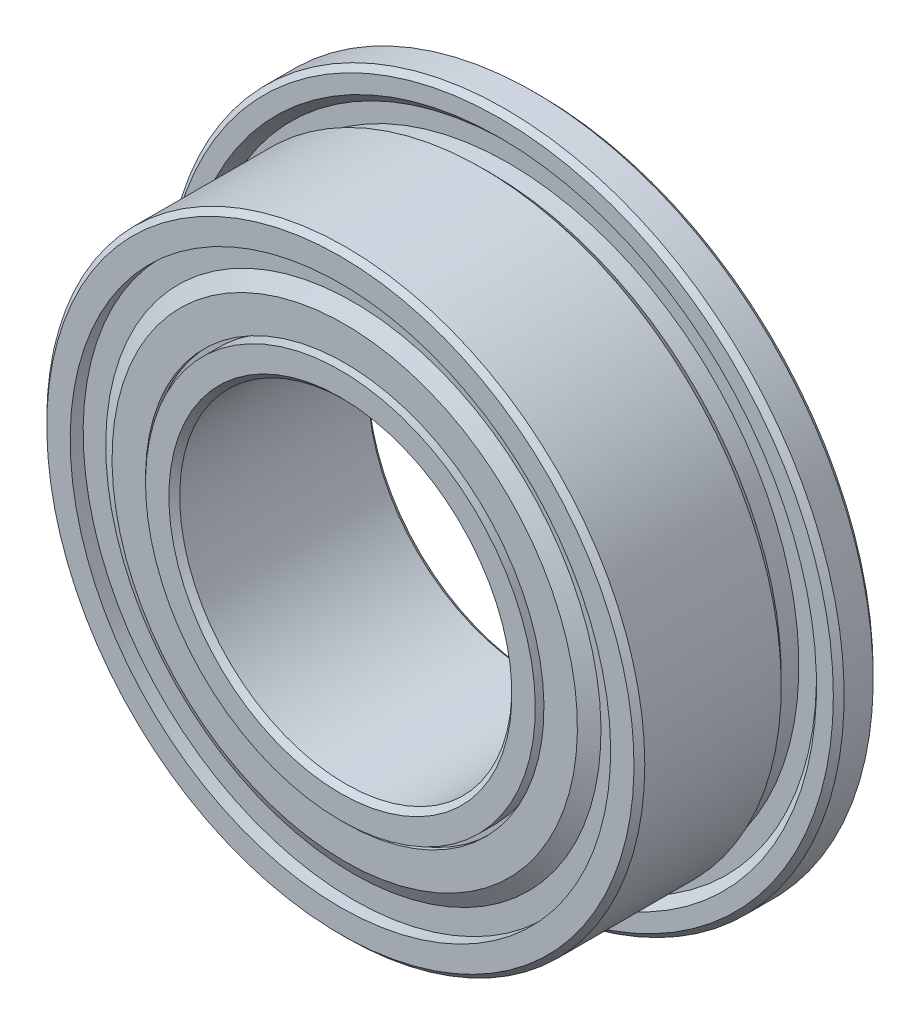
from build123d import *

# Parameters (mm, degrees)
FILLET1_SIZE      = 0.08125
FILLET2_SIZE      = 0.08125
CIRPATTERN3_COUNT = 14
SKETCH8_W         = 0.26
SKETCH8_H         = 0.216666667


with BuildPart() as part:
    # Sketch2 → Revolve1 (revolve)
    with BuildSketch(Plane(origin=(0, 0, 0), x_dir=(0, 0, -1), z_dir=(1, 0, 0)), mode=Mode.PRIVATE) as revolve1_sk:
        with BuildLine():
            Line((1.5, 5.1), (0.9, 5.1))
            Line((0.9, 5.1), (0.9, 4.765165043))
            Line((0.9, 4.765165043), (1.032582521, 4.632582521))
            Line((1.032582521, 4.632582521), (1.032582521, 4.367417479))
            Line((1.032582521, 4.367417479), (0.767417479, 4.367417479))
            Line((0.767417479, 4.367417479), (0.634834957, 4.5))
            Line((0.634834957, 4.5), (-1.5, 4.5))
            Line((-1.5, 4.5), (-1.5, 3.85))
            Line((-1.5, 3.85), (-0.487339717, 3.85))
            ThreePointArc((-0.487339717, 3.85), (0, 4.1), (0.487339717, 3.85))
            Line((0.487339717, 3.85), (1.5, 3.85))
            Line((1.5, 3.85), (1.5, 5.1))
        make_face()
        with BuildLine():
            Line((1.5, 2.5), (-1.5, 2.5))
            Line((-1.5, 2.5), (-1.5, 3.15))
            Line((-1.5, 3.15), (-0.487339717, 3.15))
            ThreePointArc((-0.487339717, 3.15), (0, 2.9), (0.487339717, 3.15))
            Line((0.487339717, 3.15), (1.5, 3.15))
            Line((1.5, 3.15), (1.5, 2.5))
        make_face()
    revolve(revolve1_sk.sketch.rotate(Axis((0, 0, 0), (0, 0, -1)), 180), axis=Axis((0, 0, 0), (0, 0, -1)))

    # Fillet1
    fillet1_edges = [part.edges().sort_by_distance(p)[0] for p in [
        (0, 4.5, 1.5),
        (0, 5.1, -1.5),
        (0, 5.1, -0.9),
    ]]
    chamfer(fillet1_edges, length=FILLET1_SIZE)

    # Fillet2
    fillet2_edges = [part.edges().sort_by_distance(p)[0] for p in [
        (0, 2.5, -1.5),
        (0, 2.5, 1.5),
    ]]
    chamfer(fillet2_edges, length=FILLET2_SIZE)

    # Sketch8 → Cut-Revolve1 (revolve, cut)
    with BuildSketch(Plane(origin=(0, 0, 0), x_dir=(0, 0, -1), z_dir=(1, 0, 0)), mode=Mode.PRIVATE) as cut_revolve1_sk:
        with Locations((-1.37, 3.958333334)):
            Rectangle(SKETCH8_W, SKETCH8_H)
        with Locations((1.37, 3.958333334)):
            Rectangle(SKETCH8_W, SKETCH8_H)
        with Locations((1.37, 3.041666667)):
            Rectangle(SKETCH8_W, SKETCH8_H)
        with Locations((-1.37, 3.041666667)):
            Rectangle(SKETCH8_W, SKETCH8_H)
    revolve(cut_revolve1_sk.sketch.rotate(Axis((0, 0, 0), (0, 0, -1)), 180), axis=Axis((0, 0, 0), (0, 0, -1)), mode=Mode.SUBTRACT)


with BuildPart() as body_2:
    # Sketch7 → Revolve3 (revolve)
    with BuildSketch(Plane.XY):
        with BuildLine():
            Line((0, 4.1), (0, 2.9))
            ThreePointArc((0, 2.9), (-0.6, 3.5), (0, 4.1))
        make_face()
    revolve(axis=Axis((0, 4.1, 0), (0, -1, 0)))


with BuildPart() as cirpattern3_1:
    # CirPattern3: pattern copy
    add(body_2.part.rotate(Axis((0, 0, 0), (0, 0, 1)), 1 * 360 / CIRPATTERN3_COUNT))


with BuildPart() as cirpattern3_2:
    # CirPattern3: pattern copy
    add(body_2.part.rotate(Axis((0, 0, 0), (0, 0, 1)), 2 * 360 / CIRPATTERN3_COUNT))


with BuildPart() as cirpattern3_3:
    # CirPattern3: pattern copy
    add(body_2.part.rotate(Axis((0, 0, 0), (0, 0, 1)), 3 * 360 / CIRPATTERN3_COUNT))


with BuildPart() as cirpattern3_4:
    # CirPattern3: pattern copy
    add(body_2.part.rotate(Axis((0, 0, 0), (0, 0, 1)), 4 * 360 / CIRPATTERN3_COUNT))


with BuildPart() as cirpattern3_5:
    # CirPattern3: pattern copy
    add(body_2.part.rotate(Axis((0, 0, 0), (0, 0, 1)), 5 * 360 / CIRPATTERN3_COUNT))


with BuildPart() as cirpattern3_6:
    # CirPattern3: pattern copy
    add(body_2.part.rotate(Axis((0, 0, 0), (0, 0, 1)), 6 * 360 / CIRPATTERN3_COUNT))


with BuildPart() as cirpattern3_7:
    # CirPattern3: pattern copy
    add(body_2.part.rotate(Axis((0, 0, 0), (0, 0, 1)), 7 * 360 / CIRPATTERN3_COUNT))


with BuildPart() as cirpattern3_8:
    # CirPattern3: pattern copy
    add(body_2.part.rotate(Axis((0, 0, 0), (0, 0, 1)), 8 * 360 / CIRPATTERN3_COUNT))


with BuildPart() as cirpattern3_9:
    # CirPattern3: pattern copy
    add(body_2.part.rotate(Axis((0, 0, 0), (0, 0, 1)), 9 * 360 / CIRPATTERN3_COUNT))


with BuildPart() as cirpattern3_10:
    # CirPattern3: pattern copy
    add(body_2.part.rotate(Axis((0, 0, 0), (0, 0, 1)), 10 * 360 / CIRPATTERN3_COUNT))


with BuildPart() as cirpattern3_11:
    # CirPattern3: pattern copy
    add(body_2.part.rotate(Axis((0, 0, 0), (0, 0, 1)), 11 * 360 / CIRPATTERN3_COUNT))


with BuildPart() as cirpattern3_12:
    # CirPattern3: pattern copy
    add(body_2.part.rotate(Axis((0, 0, 0), (0, 0, 1)), 12 * 360 / CIRPATTERN3_COUNT))


with BuildPart() as cirpattern3_13:
    # CirPattern3: pattern copy
    add(body_2.part.rotate(Axis((0, 0, 0), (0, 0, 1)), 13 * 360 / CIRPATTERN3_COUNT))


with BuildPart() as body_16:
    # Sketch9 → Revolve4 (revolve)
    with BuildSketch(Plane(origin=(0, 0, 0), x_dir=(0, 0, -1), z_dir=(1, 0, 0)), mode=Mode.PRIVATE) as revolve4_sk:
        Polygon((-1.24, 4.066666667), (-1.24, 3.70952381), (-1.37, 3.484357205), (-1.37, 2.998333333), (-1.435, 2.998333333), (-1.435, 3.501773902), (-1.305, 3.726940507), (-1.305, 4.066666667), align=None)
        Polygon((1.24, 4.066666667), (1.24, 3.70952381), (1.37, 3.484357205), (1.37, 2.998333333), (1.435, 2.998333333), (1.435, 3.501773902), (1.305, 3.726940507), (1.305, 4.066666667), align=None)
    revolve(revolve4_sk.sketch.rotate(Axis((0, 0, 0), (0, 0, -1)), 180), axis=Axis((0, 0, 0), (0, 0, -1)))


solid = Compound([part.part, body_2.part, cirpattern3_1.part, cirpattern3_2.part, cirpattern3_3.part, cirpattern3_4.part, cirpattern3_5.part, cirpattern3_6.part, cirpattern3_7.part, cirpattern3_8.part, cirpattern3_9.part, cirpattern3_10.part, cirpattern3_11.part, cirpattern3_12.part, cirpattern3_13.part, body_16.part])
